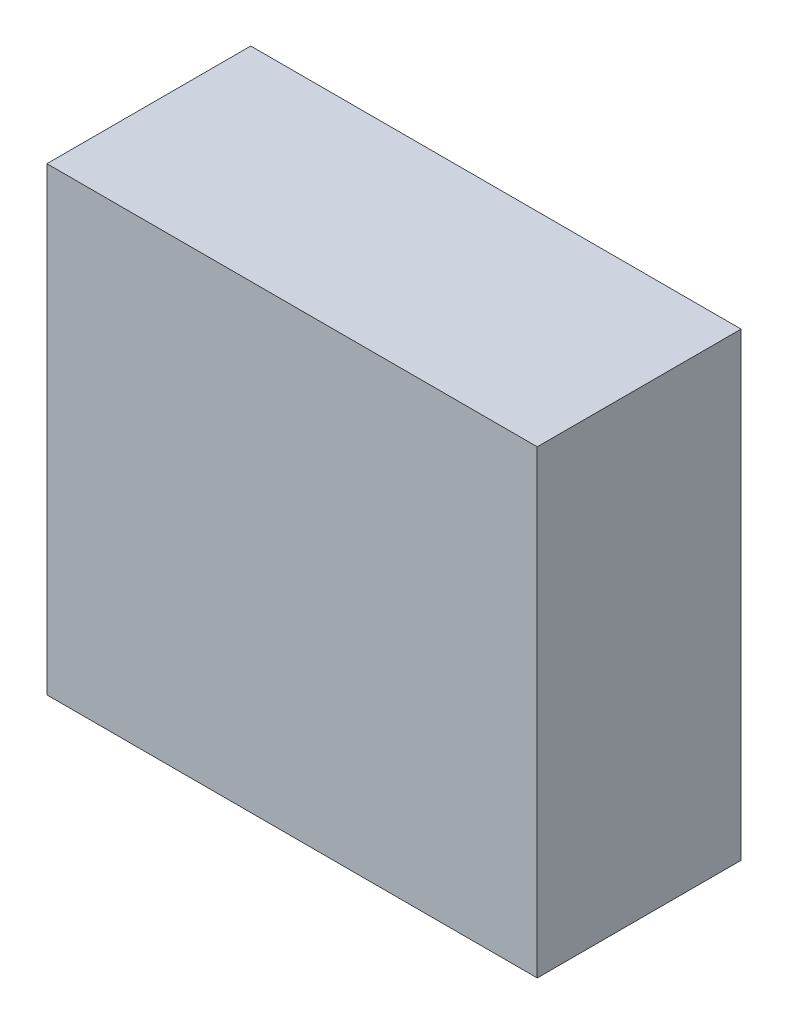
from build123d import *

# Parameters (mm, degrees)
SKETCH1_W           = 178
SKETCH1_H           = 167
BOSS_EXTRUDE1_DEPTH = 74


with BuildPart() as part:
    # Sketch1 → Boss-Extrude1 (new body)
    with BuildSketch(Plane.XY):
        with Locations((89, 83.5)):
            Rectangle(SKETCH1_W, SKETCH1_H)
    extrude(amount=BOSS_EXTRUDE1_DEPTH)


solid = part.part
